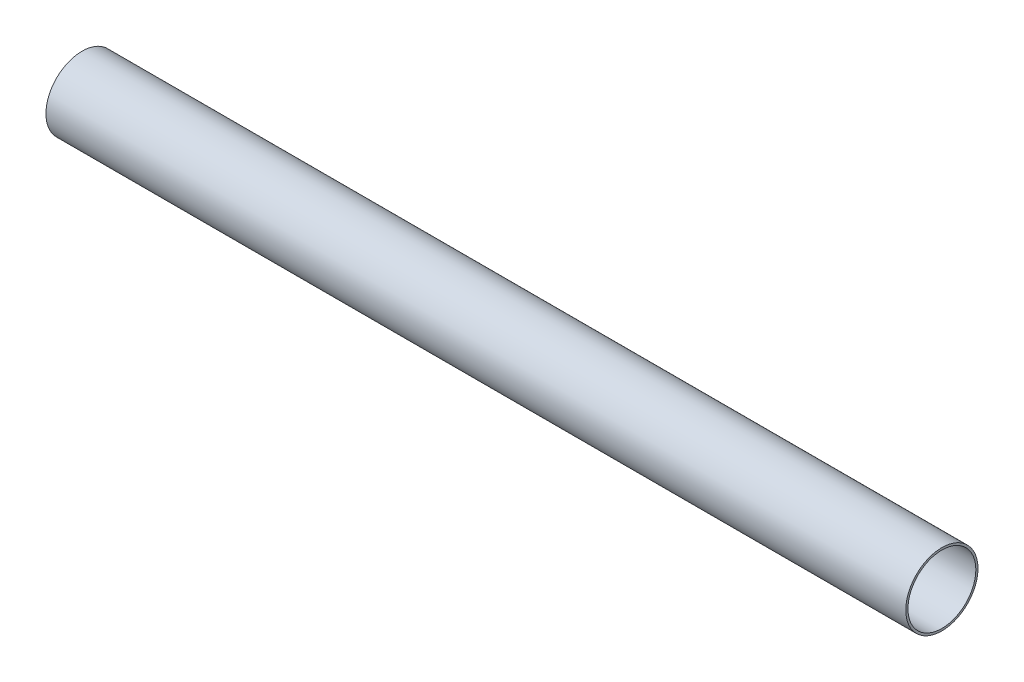
from build123d import *

# Parameters (mm, degrees)
CROQUIS1_R              = 84
CROQUIS1_R_2            = 79
SALIENTE_EXTRUIR1_DEPTH = 2000


with BuildPart() as part:
    # Croquis1 → Saliente-Extruir1 (new body)
    with BuildSketch(Plane(origin=(0, 0, 0), x_dir=(0, 0, -1), z_dir=(1, 0, 0))):
        Circle(CROQUIS1_R)
        Circle(CROQUIS1_R_2, mode=Mode.SUBTRACT)
    extrude(amount=SALIENTE_EXTRUIR1_DEPTH)


solid = part.part
